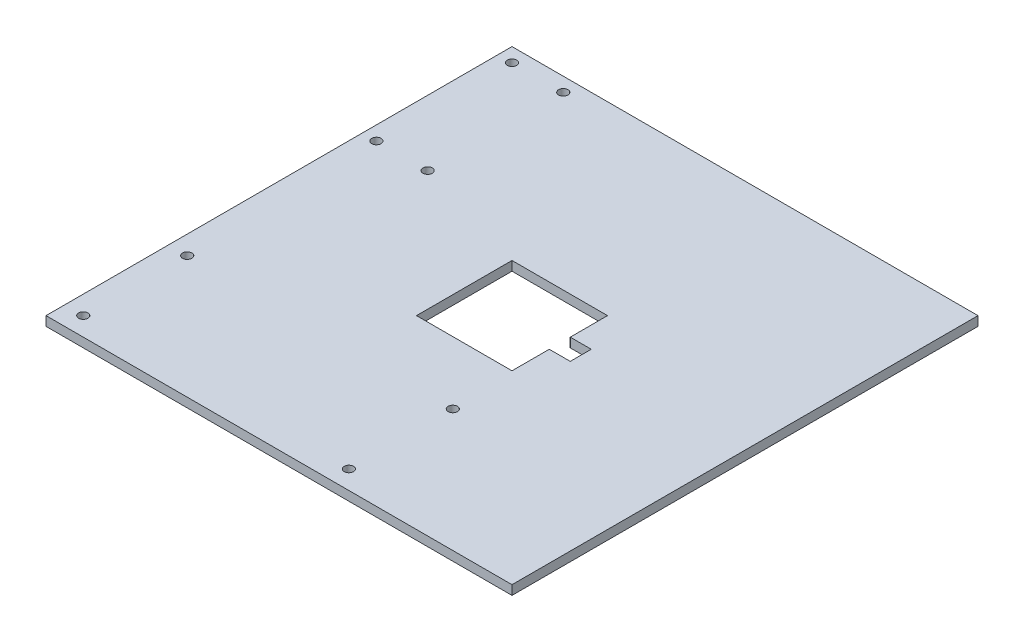
from build123d import *

# Parameters (mm, degrees)
SKETCH1_W                          = 100
SKETCH1_H                          = 100
BOSS_EXTRUDE1_DEPTH                = 2
SKETCH3_W                          = 20.5
SKETCH3_H                          = 20.5
SKETCH3_W_2                        = 4.5
SKETCH3_H_2                        = 4.5
CUT_PEG_HOLE_DEPTH                 = 2
SKETCH4_R                          = 1
CUT_RASPBERRY_PI_SCREW_HOLES_DEPTH = 2
SKETCH5_R                          = 1
CUT_ATHEROS_SCREW_HOLES_DEPTH      = 2


with BuildPart() as part:
    # Sketch1 → Boss-Extrude1 (new body)
    with BuildSketch(Plane(origin=(0, 0, 0), x_dir=(1, 0, 0), z_dir=(0, 1, 0))):
        with Locations((50, 50)):
            Rectangle(SKETCH1_W, SKETCH1_H)
    extrude(amount=BOSS_EXTRUDE1_DEPTH)

    # Sketch3 → Cut - Peg Hole (cut)
    with BuildSketch(Plane(origin=(0, 2, 0), x_dir=(1, 0, 0), z_dir=(0, 1, 0))):
        with Locations((50, 50)):
            Rectangle(SKETCH3_W, SKETCH3_H)
        with Locations((62.5, 50)):
            Rectangle(SKETCH3_W_2, SKETCH3_H_2)
    extrude(amount=-CUT_PEG_HOLE_DEPTH, mode=Mode.SUBTRACT)

    # Sketch4 → Cut - Raspberry Pi Screw Holes (cut)
    with BuildSketch(Plane(origin=(0, 2, 0), x_dir=(1, 0, 0), z_dir=(0, 1, 0))):
        with Locations(Location((4, 26.3, 0), (0, 0, 270))):
            Circle(SKETCH4_R)
        with Locations(Location((4, 4, 0), (0, 0, 270))):
            Circle(SKETCH4_R)
        with Locations(Location((61, 26.3, 0), (0, 0, 270))):
            Circle(SKETCH4_R)
        with Locations(Location((61, 4, 0), (0, 0, 270))):
            Circle(SKETCH4_R)
    extrude(amount=-CUT_RASPBERRY_PI_SCREW_HOLES_DEPTH, mode=Mode.SUBTRACT)

    # Sketch5 → Cut - Atheros Screw Holes (cut)
    with BuildSketch(Plane(origin=(0, 2, 0), x_dir=(1, 0, 0), z_dir=(0, 1, 0))):
        with Locations(Location((3, 67.9, 0), (0, 0, 270))):
            Circle(SKETCH5_R)
        with Locations(Location((14, 67.9, 0), (0, 0, 270))):
            Circle(SKETCH5_R)
        with Locations(Location((14, 97, 0), (0, 0, 270))):
            Circle(SKETCH5_R)
        with Locations(Location((3, 97, 0), (0, 0, 270))):
            Circle(SKETCH5_R)
    extrude(amount=-CUT_ATHEROS_SCREW_HOLES_DEPTH, mode=Mode.SUBTRACT)


solid = part.part
